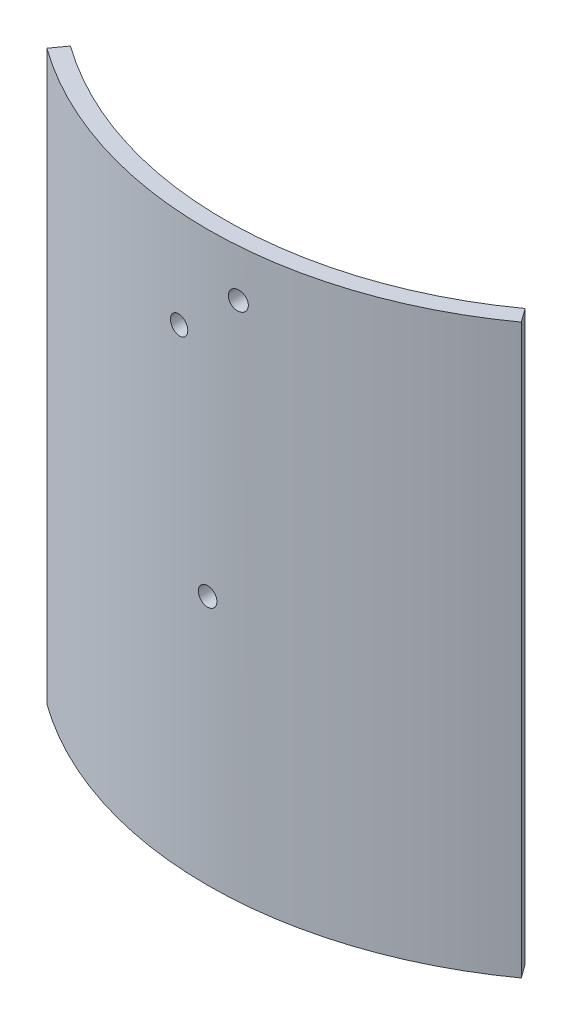
from build123d import *

# Parameters (mm, degrees)
BOSS_EXTRUDE1_DEPTH = 114.3
SKETCH2_R           = 1.7526
CUT_EXTRUDE1_DEPTH  = 25.4
SKETCH3_W           = 89.096923456
SKETCH3_H           = 11.672787919
CUT_EXTRUDE2_DEPTH  = 25.4


with BuildPart() as part:
    # Sketch1 → Boss-Extrude1 (new body)
    with BuildSketch(Plane(origin=(0, 0, 0), x_dir=(1, 0, 0), z_dir=(0, 1, 0))):
        with BuildLine():
            Line((-42.692275823, -59.245423537), (-44.548461728, -61.821311517))
            ThreePointArc((-44.548461728, -61.821311517), (0, -76.2), (44.548461728, -61.821311517))
            Line((44.548461728, -61.821311517), (42.692275823, -59.245423537))
            ThreePointArc((42.692275823, -59.245423537), (0, -73.025), (-42.692275823, -59.245423537))
        make_face()
    extrude(amount=BOSS_EXTRUDE1_DEPTH)

    # Sketch2 → Cut-Extrude1 (cut)
    with BuildSketch(Plane(origin=(0, 0, 59.245423537), x_dir=(-1, 0, 0), z_dir=(0, 0, -1))):
        with Locations((0, 54.61)):
            Circle(SKETCH2_R)
        with Locations((-5.55625, 105.41)):
            Circle(SKETCH2_R)
        with Locations((5.55625, 95.885)):
            Circle(SKETCH2_R)
    extrude(amount=-CUT_EXTRUDE1_DEPTH, mode=Mode.SUBTRACT)

    # Sketch3 → Cut-Extrude2 (cut)
    with BuildSketch(Plane(origin=(0, 0, 59.245423537), x_dir=(-1, 0, 0), z_dir=(0, 0, -1))):
        with Locations((0, 1.783606041)):
            Rectangle(SKETCH3_W, SKETCH3_H)
    extrude(amount=-CUT_EXTRUDE2_DEPTH, mode=Mode.SUBTRACT)


solid = part.part
